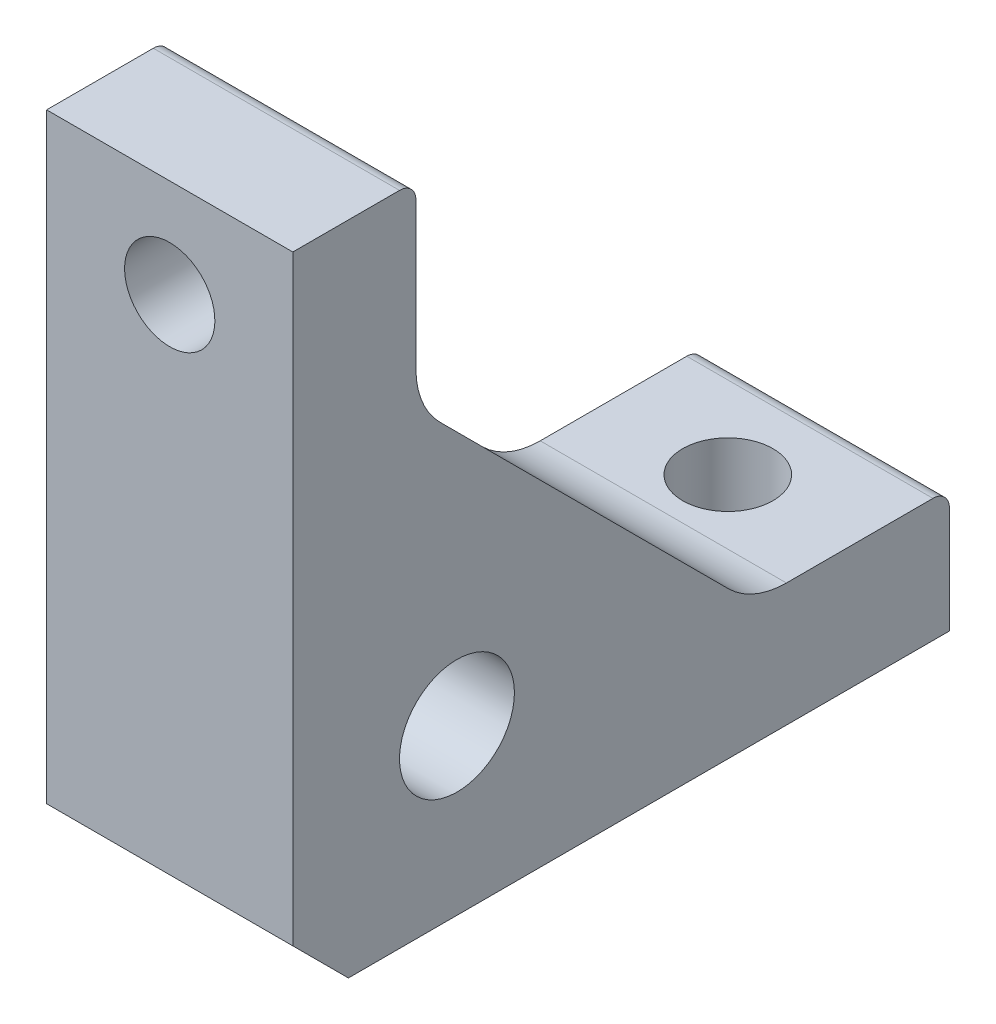
from build123d import *

# Parameters (mm, degrees)
SKETCH2_R           = 3.5
BOSS_EXTRUDE1_DEPTH = 15
SKETCH3_R           = 2.75
CUT_EXTRUDE1_DEPTH  = 15
SKETCH4_R           = 2.75
CUT_EXTRUDE2_DEPTH  = 15
FILLET1_R           = 5
FILLET2_R           = 1


with BuildPart() as part:
    # Sketch2 → Boss-Extrude1 (new body)
    with BuildSketch(Plane(origin=(0, 0, 0), x_dir=(0, 0, -1), z_dir=(1, 0, 0))):
        Polygon((0, 3.386529676), (0, 40), (7.5, 40), (7.5, 28), (28, 7.5), (40, 7.5), (40, 0), (3.386529676, 0), align=None)
        with Locations((10, 10)):
            Circle(SKETCH2_R, mode=Mode.SUBTRACT)
    extrude(amount=BOSS_EXTRUDE1_DEPTH)

    # Sketch3 → Cut-Extrude1 (cut)
    with BuildSketch(Plane(origin=(0, 7.5, 0), x_dir=(1, 0, 0), z_dir=(0, 1, 0))):
        with Locations(Location((7.5, 34, 0), (0, 0, 270))):
            Circle(SKETCH3_R)
    extrude(amount=-CUT_EXTRUDE1_DEPTH, mode=Mode.SUBTRACT)

    # Sketch4 → Cut-Extrude2 (cut)
    with BuildSketch(Plane(origin=(0, 0, -7.5), x_dir=(-1, 0, 0), z_dir=(0, 0, -1))):
        with Locations(Location((-7.5, 34, 0), (0, 0, 90))):
            Circle(SKETCH4_R)
    extrude(amount=-CUT_EXTRUDE2_DEPTH, mode=Mode.SUBTRACT)

    # Fillet1
    fillet1_edges = [part.edges().sort_by_distance(p)[0] for p in [
        (7.5, 28, -7.5),
        (7.5, 7.5, -28),
    ]]
    fillet(fillet1_edges, radius=FILLET1_R)

    # Fillet2
    fillet2_edges = [part.edges().sort_by_distance(p)[0] for p in [
        (7.5, 40, -7.5),
        (7.5, 7.5, -40),
    ]]
    fillet(fillet2_edges, radius=FILLET2_R)


solid = part.part
